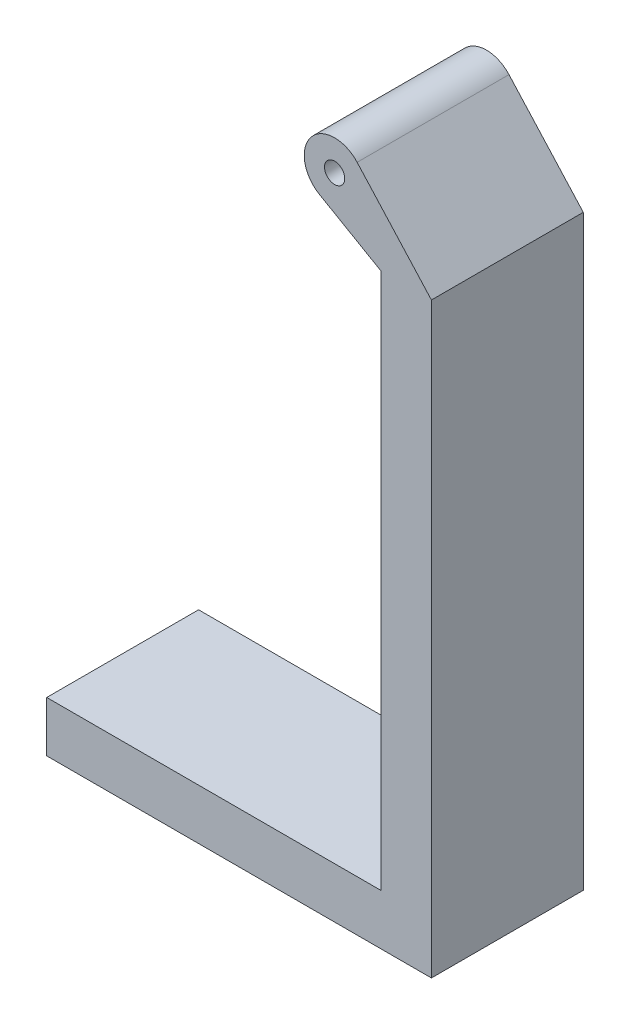
from build123d import *

# Parameters (mm, degrees)
BOSS_EXTRUDE1_DEPTH = 15
BOSS_EXTRUDE4_DEPTH = 15
SKETCH3_R           = 1
CUT_EXTRUDE1_DEPTH  = 25


with BuildPart() as part:
    # Sketch1 → Boss-Extrude1 (new body)
    with BuildSketch(Plane.XY):
        Polygon((0, 0), (38, 0), (38, 58), (33, 58), (33, 5), (0, 5), align=None)
    extrude(amount=BOSS_EXTRUDE1_DEPTH)

    # Sketch2 → Boss-Extrude4 (add)
    with BuildSketch(Plane.XY.offset(15)):
        with BuildLine():
            Line((33, 58), (26.937822174, 61.5))
            ThreePointArc((26.937822174, 61.5), (26.104169314, 65.983298832), (30.662536905, 66.110697479))
            Line((30.662536905, 66.110697479), (38, 58))
            Line((38, 58), (33, 58))
        make_face()
    extrude(amount=-BOSS_EXTRUDE4_DEPTH)

    # Sketch3 → Cut-Extrude1 (cut)
    with BuildSketch(Plane.XY.offset(15)):
        with Locations((28.437822174, 64.098076211)):
            Circle(SKETCH3_R)
    extrude(amount=-CUT_EXTRUDE1_DEPTH, mode=Mode.SUBTRACT)


solid = part.part
